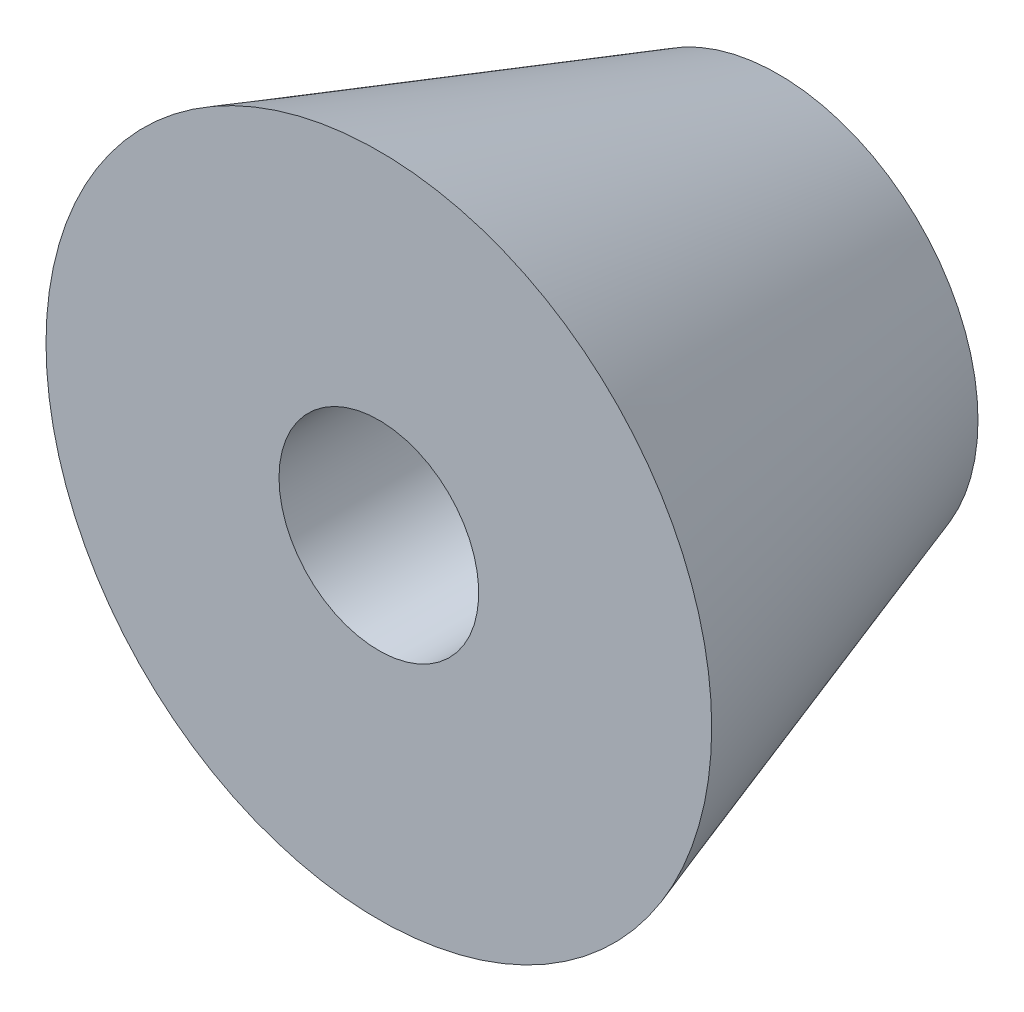
from build123d import *


with BuildPart() as part:
    # 草图1 → 旋转2 (revolve)
    with BuildSketch(Plane(origin=(0, 0, 0), x_dir=(1, 0, 0), z_dir=(0, 1, 0))):
        Polygon((-1.5, -0.688888889), (-3, -0.688888889), (-5, -6.688888889), (-1.5, -6.688888889), align=None)
    revolve(axis=Axis((0, 0, -15.666666667), (0, 0, 1)))


solid = part.part
